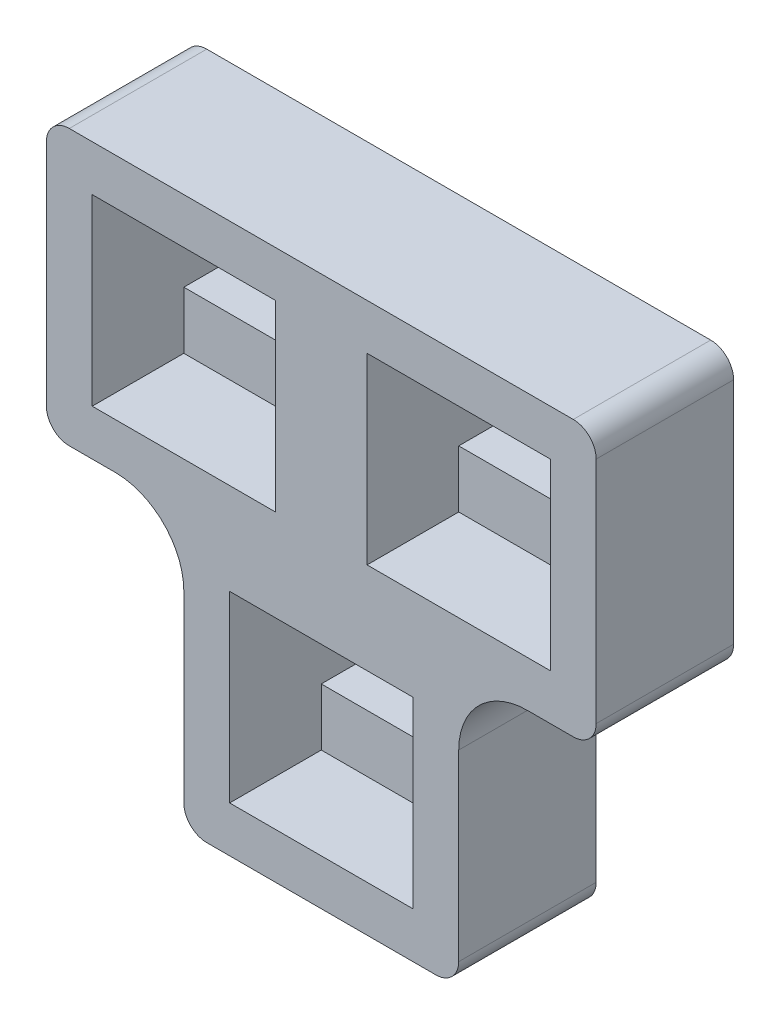
from build123d import *
from OCP.BRepFilletAPI import BRepFilletAPI_MakeFillet

# Parameters (mm, degrees)
SKETCH1_W           = 6
SKETCH1_H           = 6
BOSS_EXTRUDE1_DEPTH = 1.5
SKETCH5_W           = 6
SKETCH5_H           = 6
BOSS_EXTRUDE2_DEPTH = 3
SKETCH2_W           = 4
SKETCH2_H           = 4
CUT_EXTRUDE1_DEPTH  = 2
SKETCH10_W          = 4
SKETCH10_H          = 1.5
CUT_EXTRUDE3_DEPTH  = 9.717797887
FILLET7_R1          = 0.5
FILLET7_R2          = 1.5


with BuildPart() as part:
    # Sketch1 → Boss-Extrude1 (new, symmetric)
    with BuildSketch(Plane.XY):
        with Locations((3, 3)):
            Rectangle(SKETCH1_W, SKETCH1_H)
        with Locations((-3, 3)):
            Rectangle(SKETCH1_W, SKETCH1_H)
    extrude(amount=BOSS_EXTRUDE1_DEPTH, both=True)

    # Sketch5 → Boss-Extrude2 (add)
    with BuildSketch(Plane.XY.offset(1.5)):
        with Locations((0, -3)):
            Rectangle(SKETCH5_W, SKETCH5_H)
    extrude(amount=-BOSS_EXTRUDE2_DEPTH)

    # Sketch2 → Cut-Extrude1 (cut)
    with BuildSketch(Plane.XY.offset(1.5)):
        with Locations((3, 3)):
            Rectangle(SKETCH2_W, SKETCH2_H)
        with Locations((-3, 3)):
            Rectangle(SKETCH2_W, SKETCH2_H)
        with Locations((0, -3)):
            Rectangle(SKETCH2_W, SKETCH2_H)
    extrude(amount=-CUT_EXTRUDE1_DEPTH, mode=Mode.SUBTRACT)

    # Sketch10 → Cut-Extrude3 (cut, through all)
    with BuildSketch(Plane.XY.offset(-0.5)):
        with Locations((0, -3)):
            Rectangle(SKETCH10_W, SKETCH10_H)
        with Locations((3, 3)):
            Rectangle(SKETCH10_W, SKETCH10_H)
        with Locations((-3, 3)):
            Rectangle(SKETCH10_W, SKETCH10_H)
    extrude(amount=-CUT_EXTRUDE3_DEPTH, mode=Mode.SUBTRACT)

    # Fillet7: one fillet with a radius per group of edges: ONE call of the kernel's fillet builder (fillet() takes one radius for all edges)
    fillet7_edges_1 = [part.edges().sort_by_distance(p)[0] for p in [
        (6, 0, 0),
        (3, -6, 0),
        (6, 6, 0),
        (-6, 6, 0),
        (-6, 0, 0),
        (-3, -6, 0),
    ]]
    fillet7_edges_2 = [part.edges().sort_by_distance(p)[0] for p in [
        (3, 0, 0),
        (-3, 0, 0),
    ]]
    fillet7 = BRepFilletAPI_MakeFillet(part.part.solid().wrapped)
    for e in fillet7_edges_1:
        fillet7.Add(FILLET7_R1, e.wrapped)
    for e in fillet7_edges_2:
        fillet7.Add(FILLET7_R2, e.wrapped)
    add(Compound.cast(fillet7.Shape()), mode=Mode.REPLACE)


solid = part.part
